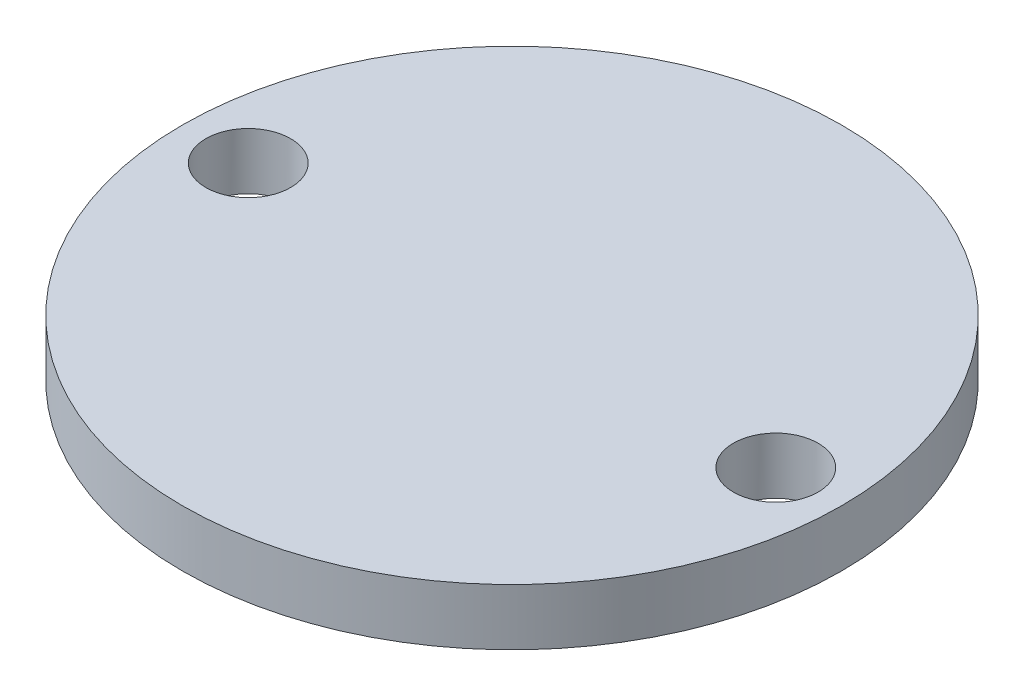
from build123d import *

# Parameters (mm, degrees)
CROQUIS3_R            = 2.25
CORTAR_EXTRUIR1_DEPTH = 28.955321497


with BuildPart() as part:
    # Croquis2 → Revolución2 (revolve)
    with BuildSketch(Plane.XY, mode=Mode.PRIVATE) as revoluci_n2_sk:
        with BuildLine():
            ThreePointArc((4.5, -2.875), (2.46221445, -1.397517486), (0, -0.875))
            Line((0, -0.875), (0, -13))
            ThreePointArc((0, -13), (2.46221445, -12.477482514), (4.5, -11))
            Line((4.5, -11), (4.5, -2.875))
        make_face()
        with BuildLine():
            ThreePointArc((6.0625, -6.9375), (5.658407738, -4.761189332), (4.5, -2.875))
            Line((4.5, -2.875), (4.5, -11))
            ThreePointArc((4.5, -11), (5.658407738, -9.113810668), (6.0625, -6.9375))
        make_face()
        with BuildLine():
            Line((4.5, 0), (0, 0))
            Line((0, 0), (0, -0.875))
            ThreePointArc((0, -0.875), (2.46221445, -1.397517486), (4.5, -2.875))
            Line((4.5, -2.875), (4.5, 0))
        make_face()
        with BuildLine():
            Line((17.5, 0), (4.5, 0))
            Line((4.5, 0), (4.5, -2.875))
            ThreePointArc((4.5, -2.875), (5.658407738, -4.761189332), (6.0625, -6.9375))
            ThreePointArc((6.0625, -6.9375), (5.658407738, -9.113810668), (4.5, -11))
            ThreePointArc((4.5, -11), (8.024807813, -7.532680371), (10, -3))
            Line((10, -3), (17.5, -3))
            Line((17.5, -3), (17.5, 0))
        make_face()
    revolve(revoluci_n2_sk.sketch.rotate(Axis((0, 0, 0), (0, -1, 0)), 90), axis=Axis((0, 0, 0), (0, -1, 0)))

    # Croquis3 → Cortar-Extruir1 (cut, through all)
    with BuildSketch(Plane(origin=(0, 0, 0), x_dir=(1, 0, 0), z_dir=(0, 1, 0))):
        with Locations(Location((14, 0, 0), (0, 0, 270))):
            Circle(CROQUIS3_R)
        with Locations(Location((-14, 0, 0), (0, 0, 270))):
            Circle(CROQUIS3_R)
    extrude(amount=-CORTAR_EXTRUIR1_DEPTH, mode=Mode.SUBTRACT)


solid = part.part
